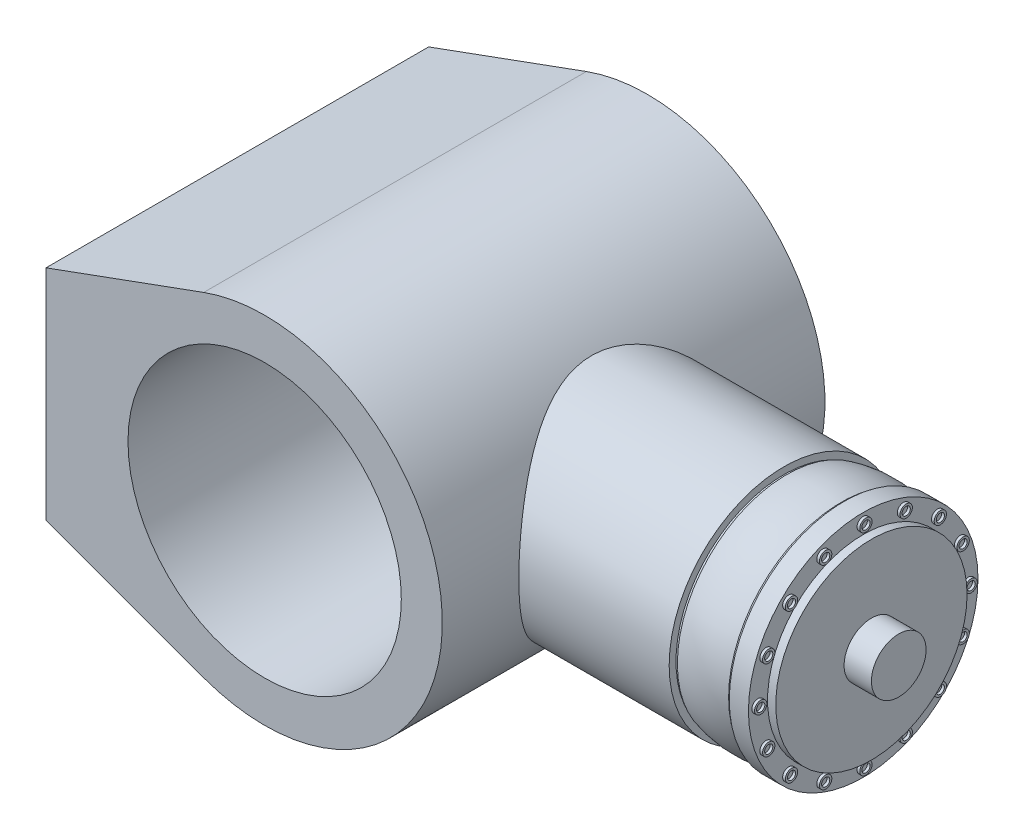
from build123d import *

# Parameters (mm, degrees)
SKETCH1_R                = 50
BOSS_EXTRUDE1_DEPTH      = 70
BOSS_EXTRUDE2_REACH      = 223.642
BOSS_EXTRUDE2_END_RADIUS = 65
SKETCH2_R                = 42
SKETCH3_R                = 39.5
BOSS_EXTRUDE3_DEPTH      = 1
SKETCH6_R                = 41.25
BOSS_EXTRUDE4_DEPTH      = 1
BOSS_EXTRUDE5_START      = 7
SKETCH7_R                = 42
BOSS_EXTRUDE5_DEPTH      = 7
SKETCH8_R                = 35
BOSS_EXTRUDE6_DEPTH      = 3
SKETCH9_R                = 2.25
SKETCH9_R_2              = 1.5
BOSS_EXTRUDE8_DEPTH      = 1
CIRPATTERN1_COUNT        = 16
SKETCH10_R               = 10
BOSS_EXTRUDE9_DEPTH      = 10


with BuildPart() as part:
    # Sketch1 → Boss-Extrude1 (new, symmetric)
    with BuildSketch(Plane.XY):
        with BuildLine():
            Line((-80, -40), (-80, 40))
            Line((-80, 40), (-22.281665693, 61.061668614))
            ThreePointArc((-22.281665693, 61.061668614), (65, 0), (-22.281665693, -61.061668614))
            Line((-22.281665693, -61.061668614), (-80, -40))
        make_face()
        Circle(SKETCH1_R, mode=Mode.SUBTRACT)
    extrude(amount=BOSS_EXTRUDE1_DEPTH, both=True)

    # Boss-Extrude2: up to this cylinder (the profile starts outside it)
    boss_extrude2_end = Plane(origin=(0, 0, 0), z_dir=(0, 0, -1)) * Cylinder(BOSS_EXTRUDE2_END_RADIUS, 578.284, mode=Mode.PRIVATE)
    # Sketch2 → Boss-Extrude2 (add, up to the surface)
    with BuildSketch(Plane(origin=(120, 0, 0), x_dir=(0, 0, -1), z_dir=(1, 0, 0)), mode=Mode.PRIVATE) as boss_extrude2_sk1:
        Circle(SKETCH2_R)
    boss_extrude2_tool1 = extrude(boss_extrude2_sk1.sketch, amount=-BOSS_EXTRUDE2_REACH, mode=Mode.PRIVATE) - boss_extrude2_end
    add(boss_extrude2_tool1.solids().sort_by_distance((120, 0, 0))[0])

    # Sketch3 → Boss-Extrude3 (add)
    with BuildSketch(Plane(origin=(120, 0, 0), x_dir=(0, 0, -1), z_dir=(1, 0, 0))):
        Circle(SKETCH3_R)
    extrude(amount=BOSS_EXTRUDE3_DEPTH)

    # Sketch5 → Revolve1 (revolve)
    with BuildSketch(Plane.XY, mode=Mode.PRIVATE) as revolve1_sk:
        with BuildLine():
            Line((121, 0), (121, 40))
            ThreePointArc((121, 40), (131, 41.376973739), (141, 40))
            Line((141, 40), (141, 0))
            Line((141, 0), (121, 0))
        make_face()
    revolve(revolve1_sk.sketch.rotate(Axis((121, 0, 0), (1, 0, 0)), 90), axis=Axis((121, 0, 0), (1, 0, 0)))

    # Sketch6 → Boss-Extrude4 (add)
    with BuildSketch(Plane(origin=(141, 0, 0), x_dir=(0, 0, -1), z_dir=(1, 0, 0))):
        Circle(SKETCH6_R)
    extrude(amount=BOSS_EXTRUDE4_DEPTH)

    # Sketch7 → Boss-Extrude5 (add)
    with BuildSketch(Plane(origin=(142, 0, 0), x_dir=(0, 0, -1), z_dir=(1, 0, 0)).offset(BOSS_EXTRUDE5_START)):
        Circle(SKETCH7_R)
    boss_extrude5 = extrude(amount=-BOSS_EXTRUDE5_DEPTH)

    # Sketch8 → Boss-Extrude6 (add)
    with BuildSketch(Plane(origin=(149, 0, 0), x_dir=(0, 0, -1), z_dir=(1, 0, 0))):
        Circle(SKETCH8_R)
    extrude(amount=BOSS_EXTRUDE6_DEPTH)

    # Sketch9 → Boss-Extrude8 (add)
    with BuildSketch(Plane(origin=(149, 0, 0), x_dir=(0, 0, -1), z_dir=(1, 0, 0))):
        with Locations((38.5, 0)):
            Circle(SKETCH9_R)
        with Locations((38.5, 0)):
            Circle(SKETCH9_R_2, mode=Mode.SUBTRACT)
    boss_extrude8 = extrude(amount=BOSS_EXTRUDE8_DEPTH)

    # CirPattern1: Boss-Extrude5, Boss-Extrude8 ×16 about axis
    cirpattern1_axis = Axis((0, 0, 0), (1, 0, 0))
    add([boss_extrude5.rotate(cirpattern1_axis, i * 360 / CIRPATTERN1_COUNT) for i in range(1, CIRPATTERN1_COUNT)])
    add([boss_extrude8.rotate(cirpattern1_axis, i * 360 / CIRPATTERN1_COUNT) for i in range(1, CIRPATTERN1_COUNT)])

    # Sketch10 → Boss-Extrude9 (add)
    with BuildSketch(Plane(origin=(152, 0, 0), x_dir=(0, 0, -1), z_dir=(1, 0, 0))):
        Circle(SKETCH10_R)
    extrude(amount=BOSS_EXTRUDE9_DEPTH)


solid = part.part
